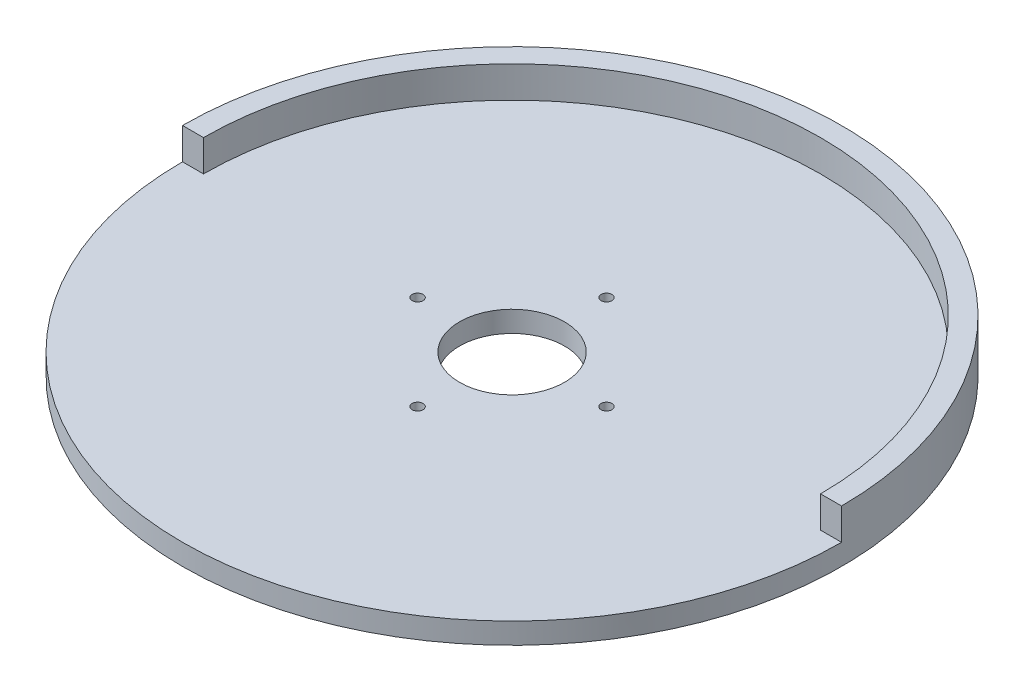
from build123d import *

# Parameters (mm, degrees)
SKETCH2_R           = 157
BOSS_EXTRUDE1_DEPTH = 10
BOSS_EXTRUDE2_START = 15
BOSS_EXTRUDE2_DEPTH = 15
SKETCH4_R           = 25
CUT_EXTRUDE1_DEPTH  = 223.537637266
SKETCH5_R           = 2.6
CUT_EXTRUDE2_DEPTH  = 224.434554176
CIRPATTERN1_COUNT   = 4


with BuildPart() as part:
    # Sketch2 → Boss-Extrude1 (new body)
    with BuildSketch(Plane(origin=(0, 0, 0), x_dir=(1, 0, 0), z_dir=(0, 1, 0))):
        with Locations(Location((0, 0, 0), (0, 0, 270))):
            Circle(SKETCH2_R)
    extrude(amount=-BOSS_EXTRUDE1_DEPTH)

    # Sketch3 → Boss-Extrude2 (add)
    with BuildSketch(Plane(origin=(0, 0, 0), x_dir=(1, 0, 0), z_dir=(0, 1, 0)).offset(BOSS_EXTRUDE2_START)):
        with BuildLine():
            ThreePointArc((157, 0), (0, 157), (-157, 0))
            Line((-157, 0), (-147, 0))
            ThreePointArc((-147, 0), (0, 147), (147, 0))
            Line((147, 0), (157, 0))
        make_face()
    extrude(amount=-BOSS_EXTRUDE2_DEPTH)

    # Sketch4 → Cut-Extrude1 (cut, through all)
    with BuildSketch(Plane(origin=(0, 0, 0), x_dir=(1, 0, 0), z_dir=(0, 1, 0))):
        with Locations(Location((0, 0, 0), (0, 0, 270))):
            Circle(SKETCH4_R)
    extrude(amount=-CUT_EXTRUDE1_DEPTH, mode=Mode.SUBTRACT)

    # Sketch5 → Cut-Extrude2 (cut, through all)
    with BuildSketch(Plane.XZ.offset(10)):
        with Locations(Location((0, 45, 0), (0, 0, 270))):
            Circle(SKETCH5_R)
    cut_extrude2 = extrude(amount=-CUT_EXTRUDE2_DEPTH, mode=Mode.SUBTRACT)

    # CirPattern1: Cut-Extrude2 ×4 about axis
    cirpattern1_axis = Axis((0, 0, 0), (0, 1, 0))
    for i in range(1, CIRPATTERN1_COUNT):
        add(cut_extrude2.rotate(cirpattern1_axis, i * 360 / CIRPATTERN1_COUNT), mode=Mode.SUBTRACT)


solid = part.part
